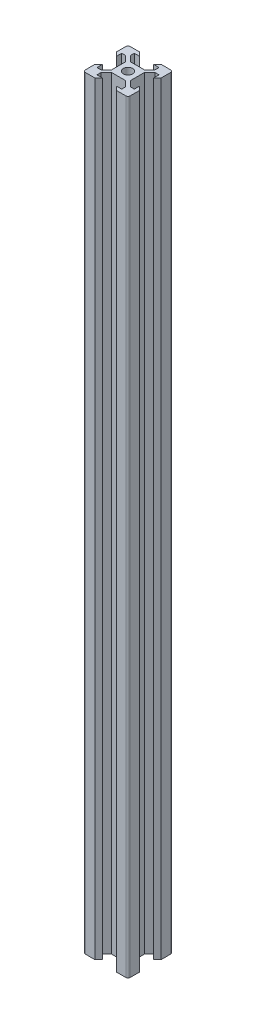
from build123d import *

# Parameters (mm, degrees)
MASTERLAYOUTSKETCH_R = 2.1
MAIN_EXTRUSION_DEPTH = 340
EDGE_FILLETS_R       = 1


with BuildPart() as part:
    # MasterLayoutSketch → Main Extrusion (new body)
    with BuildSketch(Plane(origin=(0, 0, 0), x_dir=(1, 0, 0), z_dir=(0, 1, 0))):
        Polygon((-8.325, 3.1), (-8.325, 5.5), (-6.560660172, 5.5), (-4.160660172, 3.1), (-4.160660172, -3.1), (-6.560660172, -5.5), (-8.325, -5.5), (-8.325, -3.1), (-10, -4.775), (-10, -10), (-4.775, -10), (-3.1, -8.325), (-5.5, -8.325), (-5.5, -6.560660172), (-3.1, -4.160660172), (3.1, -4.160660172), (5.5, -6.560660172), (5.5, -8.325), (3.1, -8.325), (4.775, -10), (10, -10), (10, -4.775), (8.325, -3.1), (8.325, -5.5), (6.560660172, -5.5), (4.160660172, -3.1), (4.160660172, 3.1), (6.560660172, 5.5), (8.325, 5.5), (8.325, 3.1), (10, 4.775), (10, 10), (4.775, 10), (3.1, 8.325), (5.5, 8.325), (5.5, 6.560660172), (3.1, 4.160660172), (-3.1, 4.160660172), (-5.5, 6.560660172), (-5.5, 8.325), (-3.1, 8.325), (-4.775, 10), (-10, 10), (-10, 4.775), align=None)
        with Locations(Location((0, 0, 0), (0, 0, 270))):
            Circle(MASTERLAYOUTSKETCH_R, mode=Mode.SUBTRACT)
    extrude(amount=MAIN_EXTRUSION_DEPTH)

    # Edge Fillets
    edge_fillets_edges = [part.edges().sort_by_distance(p)[0] for p in [
        (10, 170, -10),
        (10, 170, 10),
        (-10, 170, 10),
        (-10, 170, -10),
    ]]
    fillet(edge_fillets_edges, radius=EDGE_FILLETS_R)


solid = part.part
